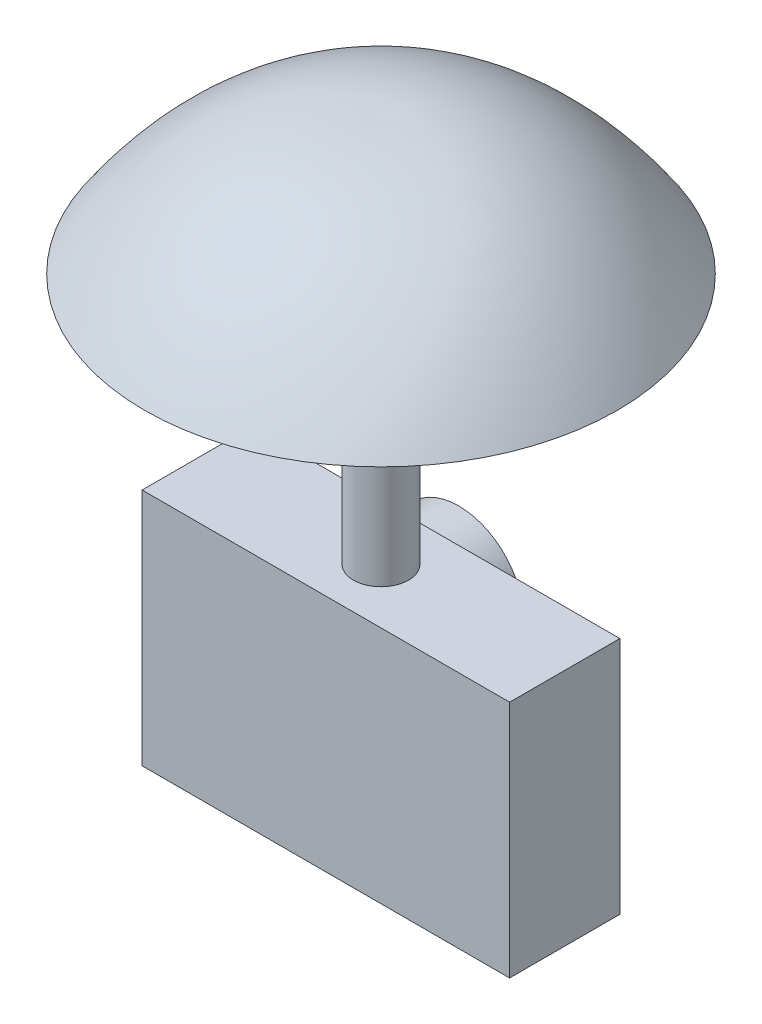
from build123d import *

# Parameters (mm, degrees)
SKETCH1_W           = 20
SKETCH1_H           = 6
BOSS_EXTRUDE1_DEPTH = 13
SKETCH2_R           = 1.5
BOSS_EXTRUDE3_DEPTH = 34
SKETCH6_R           = 3.50549755
BOSS_EXTRUDE4_DEPTH = 5


with BuildPart() as part:
    # Sketch1 → Boss-Extrude1 (new body)
    with BuildSketch(Plane(origin=(0, 0, 0), x_dir=(1, 0, 0), z_dir=(0, 1, 0))):
        with Locations((10, 3)):
            Rectangle(SKETCH1_W, SKETCH1_H)
    extrude(amount=BOSS_EXTRUDE1_DEPTH)

    # Sketch2 → Boss-Extrude3 (add)
    with BuildSketch(Plane.XZ):
        with Locations(Location((10, -3, 0), (0, 0, 270))):
            Circle(SKETCH2_R)
    extrude(amount=-BOSS_EXTRUDE3_DEPTH)

    # Sketch5 → Revolve1 (revolve)
    with BuildSketch(Plane.XY.offset(-3), mode=Mode.PRIVATE) as revolve1_sk:
        with BuildLine():
            Line((10, 34), (10, 26.687164187))
            Line((10, 26.687164187), (-2.865987709, 26.687164187))
            add(Edge.make_bspline(
                [(10, 34), (2.373080753, 34.40580884), (-2.865987709, 26.687164187)],
                knots=[0, 0, 0, 1, 1, 1], degree=2))
        make_face()
    revolve(revolve1_sk.sketch.rotate(Axis((10, 34, -3), (0, -1, 0)), 90), axis=Axis((10, 34, -3), (0, -1, 0)))

    # Sketch6 → Boss-Extrude4 (add)
    with BuildSketch(Plane(origin=(0, 0, -6), x_dir=(-1, 0, 0), z_dir=(0, 0, -1))):
        with Locations(Location((-6.235505229, 6.359969697, 0), (0, 0, 180))):
            Circle(SKETCH6_R)
    extrude(amount=BOSS_EXTRUDE4_DEPTH)


solid = part.part
